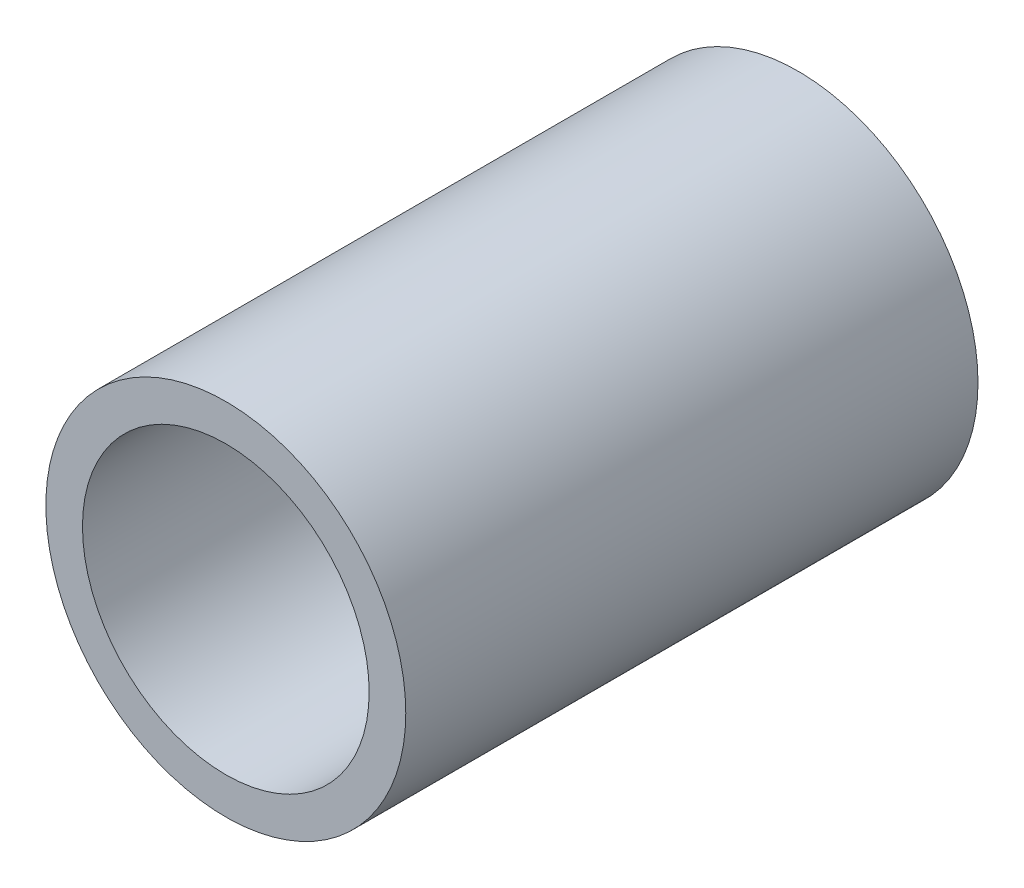
from build123d import *

# Parameters (mm, degrees)
BOSS_EXTRUDE1_DEPTH      = 6.35
BOSS_EXTRUDE1_DEPTH_BACK = 6.35
SKETCH5_R                = 3.99415
SKETCH5_R_2              = 3.18135


with BuildPart() as part:
    # Sketch5 → Boss-Extrude1 (new, two sides: drawn at the far end of the back side and taken through both)
    with BuildSketch(Plane.XY.offset(-BOSS_EXTRUDE1_DEPTH_BACK)):
        Circle(SKETCH5_R)
        Circle(SKETCH5_R_2, mode=Mode.SUBTRACT)
    extrude(amount=BOSS_EXTRUDE1_DEPTH + BOSS_EXTRUDE1_DEPTH_BACK)


solid = part.part
